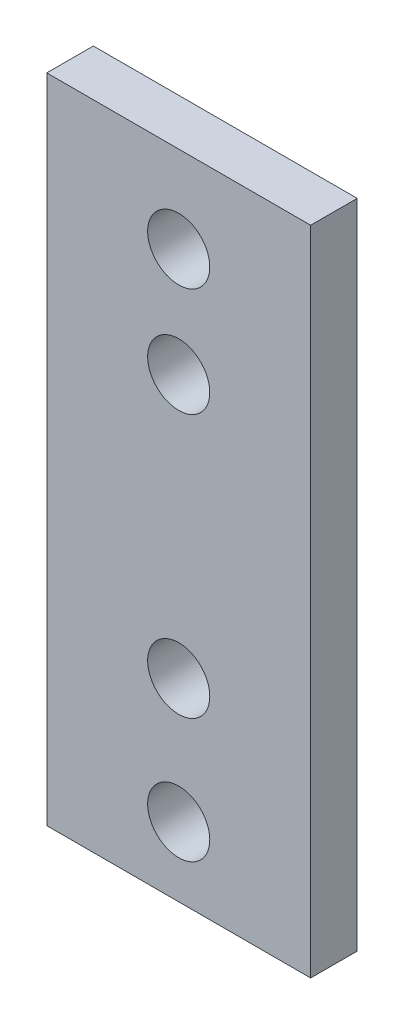
from build123d import *

# Parameters (mm, degrees)
SKETCH_1_W      = 17
SKETCH_1_H      = 42
SKETCH_1_R      = 2
EXTRUDE_1_DEPTH = 3


with BuildPart() as part:
    # 草圖1 → 填料-伸長1 (new body)
    with BuildSketch(Plane.XY):
        with Locations((-5.84751773, -5.464539007)):
            Rectangle(SKETCH_1_W, SKETCH_1_H)
        with Locations((-5.84751773, 9.953900709)):
            Circle(SKETCH_1_R, mode=Mode.SUBTRACT)
        with Locations((-5.84751773, 2.953900709)):
            Circle(SKETCH_1_R, mode=Mode.SUBTRACT)
        with Locations((-5.84751773, -14.003546099)):
            Circle(SKETCH_1_R, mode=Mode.SUBTRACT)
        with Locations((-5.84751773, -22.003546099)):
            Circle(SKETCH_1_R, mode=Mode.SUBTRACT)
    extrude(amount=EXTRUDE_1_DEPTH)


solid = part.part
